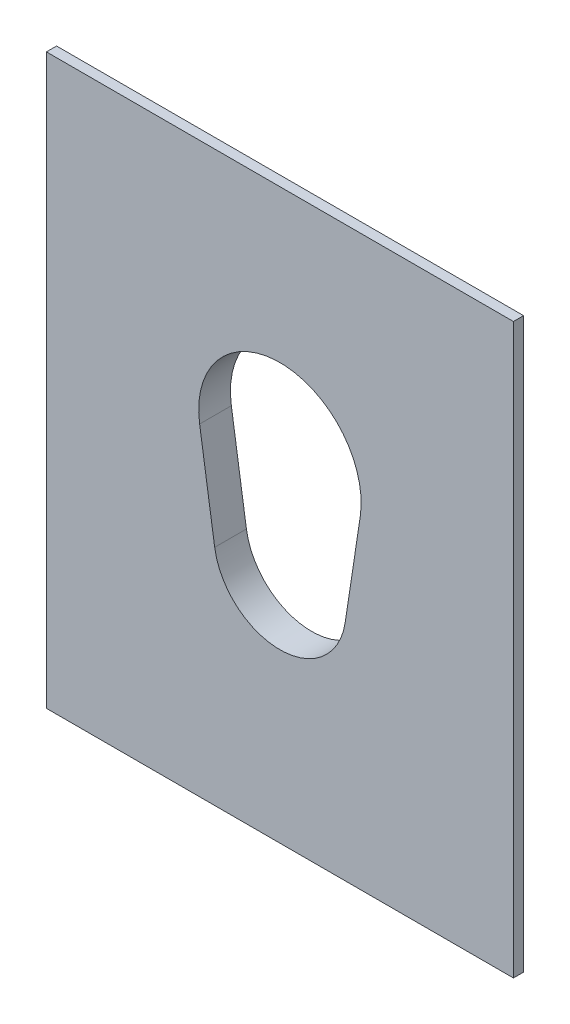
from build123d import *

# Parameters (mm, degrees)
SKETCH1_W           = 26
SKETCH1_H           = 36
BOSS_EXTRUDE1_DEPTH = 1.5625
SKETCH2_W           = 46
SKETCH2_H           = 56
SKETCH2_W_2         = 26
SKETCH2_H_2         = 36
BOSS_EXTRUDE2_DEPTH = 1


with BuildPart() as part:
    # Sketch1 → Boss-Extrude1 (new, symmetric)
    with BuildSketch(Plane.XY):
        with Locations((0, 5)):
            Rectangle(SKETCH1_W, SKETCH1_H)
        with BuildLine():
            Line((-6.426458978, -0.975), (-7.909487973, 8.8))
            ThreePointArc((-7.909487973, 8.8), (0, 18), (7.909487973, 8.8))
            Line((7.909487973, 8.8), (6.426458978, -0.975))
            ThreePointArc((6.426458978, -0.975), (0, -6.5), (-6.426458978, -0.975))
        make_face(mode=Mode.SUBTRACT)
    extrude(amount=BOSS_EXTRUDE1_DEPTH, both=True)

    # Sketch2 → Boss-Extrude2 (add)
    with BuildSketch(Plane(origin=(0, 0, 1.5625), x_dir=(-1, 0, 0), z_dir=(0, 0, -1))):
        with Locations((0, 5)):
            Rectangle(SKETCH2_W, SKETCH2_H)
        with Locations((0, 5)):
            Rectangle(SKETCH2_W_2, SKETCH2_H_2, mode=Mode.SUBTRACT)
    extrude(amount=BOSS_EXTRUDE2_DEPTH)


solid = part.part
